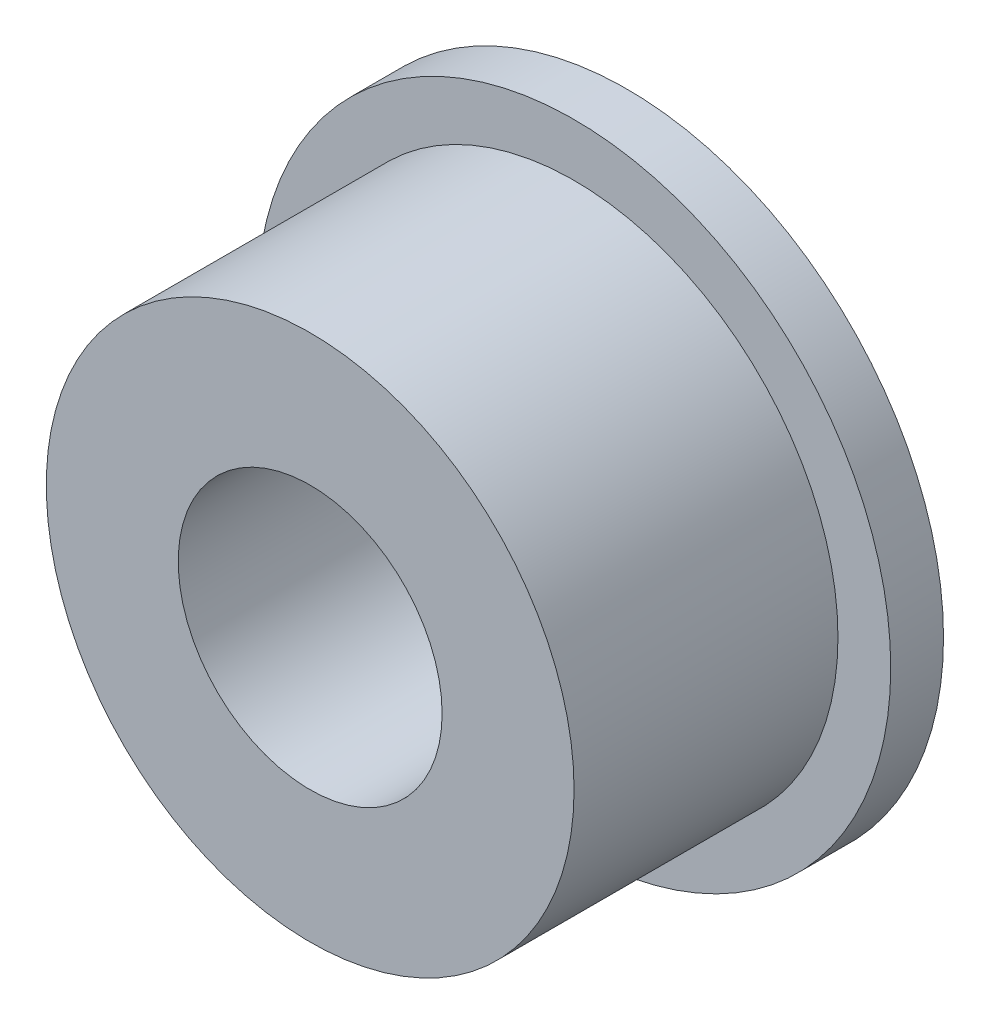
from build123d import *


with BuildPart() as part:
    # 草图8 → 旋转1 (revolve)
    with BuildSketch(Plane(origin=(0, 0, 0), x_dir=(1, 0, 0), z_dir=(0, 1, 0))):
        Polygon((25, -60), (25, -20), (0, -20), (0, 0), (60, 0), (60, -10), (50, -10), (50, -60), align=None)
    revolve(axis=Axis((0, 0, 20), (0, 0, -1)))


solid = part.part
